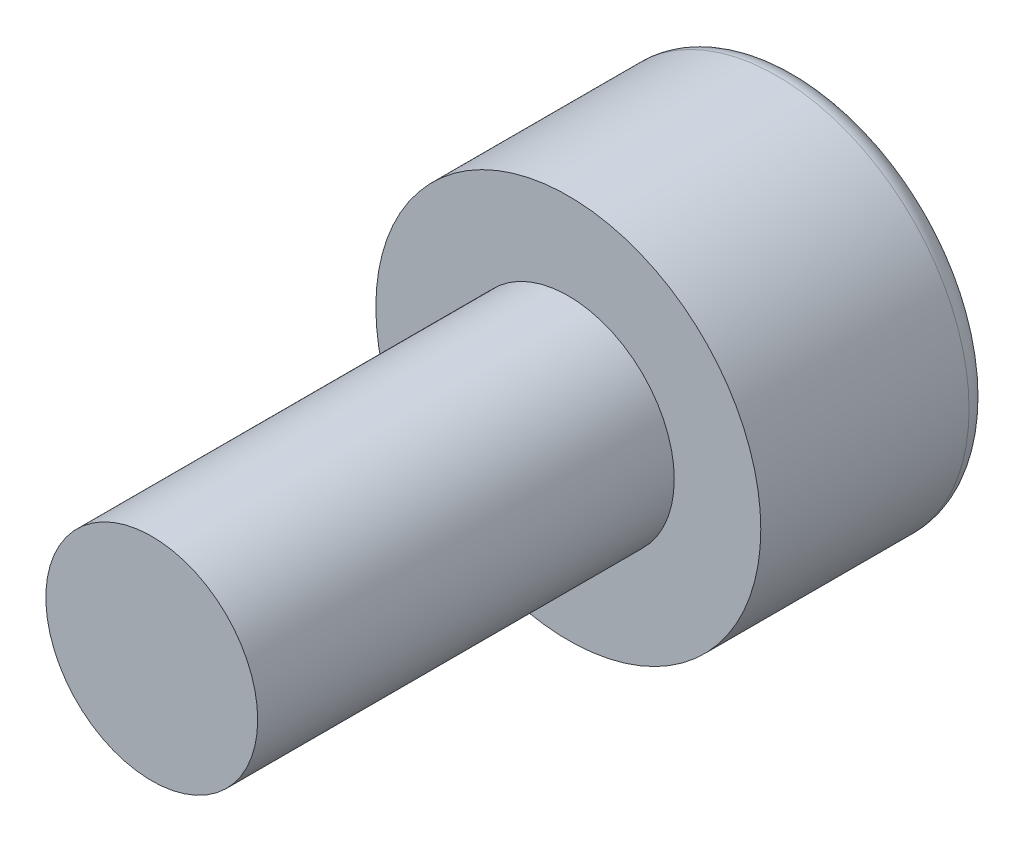
from build123d import *

# Parameters (mm, degrees)
CROQUIS1_R              = 1.475
SALIENTE_EXTRUIR1_DEPTH = 5.8
CROQUIS2_R              = 2.68
SALIENTE_EXTRUIR2_DEPTH = 3.2
CORTAR_EXTRUIR1_DEPTH   = 2.5
REDONDEO1_R             = 0.3


with BuildPart() as part:
    # Croquis1 → Saliente-Extruir1 (new body)
    with BuildSketch(Plane.XY):
        Circle(CROQUIS1_R)
    extrude(amount=SALIENTE_EXTRUIR1_DEPTH)

    # Croquis2 → Saliente-Extruir2 (add)
    with BuildSketch(Plane(origin=(0, 0, 0), x_dir=(-1, 0, 0), z_dir=(0, 0, -1))):
        Circle(CROQUIS2_R)
    extrude(amount=SALIENTE_EXTRUIR2_DEPTH)

    # Croquis3 → Cortar-Extruir1 (cut)
    with BuildSketch(Plane(origin=(0, 0, -3.2), x_dir=(-1, 0, 0), z_dir=(0, 0, -1))):
        Polygon((0, -1.776735144), (1.53869777, -0.888367572), (1.53869777, 0.888367572), (0, 1.776735144), (-1.53869777, 0.888367572), (-1.53869777, -0.888367572), align=None)
    extrude(amount=-CORTAR_EXTRUIR1_DEPTH, mode=Mode.SUBTRACT)

    # Redondeo1
    redondeo1_edges = [part.edges().sort_by_distance(p)[0] for p in [
        (2.68, 0, -3.2),
    ]]
    fillet(redondeo1_edges, radius=REDONDEO1_R)


solid = part.part
